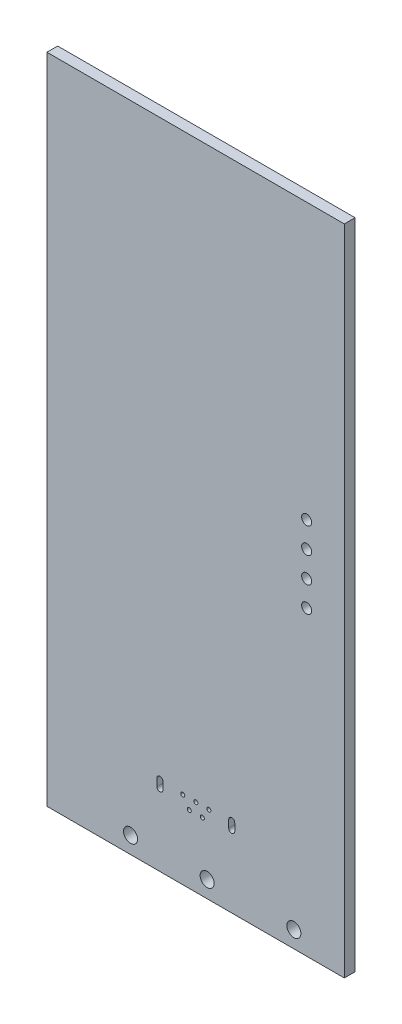
from build123d import *

# Parameters (mm, degrees)
SKETCH_1_W         = 29.6
SKETCH_1_H         = 65
BOARD_DEPTH        = 1.07112
SKETCH_13_R        = 0.5
HOLE_OLED1_4_DEPTH = 1.07112
SKETCH_14_R        = 0.5
HOLE_OLED1_3_DEPTH = 148.296881579
SKETCH_15_R        = 0.5
HOLE_OLED1_2_DEPTH = 148.296881579
SKETCH_16_R        = 0.5
HOLE_OLED1_1_DEPTH = 148.296881579
SKETCH_17_R        = 0.7
HOLE_FREE_4_DEPTH  = 148.296881579
SKETCH_18_R        = 0.7
HOLE_FREE_3_DEPTH  = 148.296881579
SKETCH_19_R        = 0.7
HOLE_FREE_2_DEPTH  = 148.296881579
HOLE_J1_6_DEPTH    = 148.296881579
HOLE_J1_7_DEPTH    = 148.296881579
SKETCH_24_R        = 0.2
HOLE_J1_1_DEPTH    = 148.296881579
SKETCH_25_R        = 0.2
HOLE_J1_2_DEPTH    = 148.296881579
SKETCH_26_R        = 0.2
HOLE_J1_3_DEPTH    = 148.296881579
SKETCH_27_R        = 0.2
HOLE_J1_4_DEPTH    = 148.296881579
SKETCH_28_R        = 0.2
HOLE_J1_5_DEPTH    = 148.296881579


with BuildPart() as part:
    # Эскиз1 → Board (new body)
    with BuildSketch(Plane.XY):
        with Locations((71.88103, 86.58662)):
            Rectangle(SKETCH_1_W, SKETCH_1_H)
    extrude(amount=BOARD_DEPTH)

    # Эскиз13 → Hole - OLED1-4 (cut)
    with BuildSketch(Plane.XY.offset(1.07112)):
        with Locations((82.93099, 84.09263)):
            Circle(SKETCH_13_R)
    extrude(amount=-HOLE_OLED1_4_DEPTH, mode=Mode.SUBTRACT)

    # Эскиз14 → Hole - OLED1-3 (cut, through all)
    with BuildSketch(Plane.XY.offset(1.07112)):
        with Locations((82.931, 86.63263)):
            Circle(SKETCH_14_R)
    extrude(amount=-HOLE_OLED1_3_DEPTH, mode=Mode.SUBTRACT)

    # Эскиз15 → Hole - OLED1-2 (cut, through all)
    with BuildSketch(Plane.XY.offset(1.07112)):
        with Locations((82.931, 89.17263)):
            Circle(SKETCH_15_R)
    extrude(amount=-HOLE_OLED1_2_DEPTH, mode=Mode.SUBTRACT)

    # Эскиз16 → Hole - OLED1-1 (cut, through all)
    with BuildSketch(Plane.XY.offset(1.07112)):
        with Locations((82.931, 91.71263)):
            Circle(SKETCH_16_R)
    extrude(amount=-HOLE_OLED1_1_DEPTH, mode=Mode.SUBTRACT)

    # Эскиз17 → Hole - Free-4 (cut, through all)
    with BuildSketch(Plane.XY.offset(1.07112)):
        with Locations((73.025, 55.753)):
            Circle(SKETCH_17_R)
    extrude(amount=-HOLE_FREE_4_DEPTH, mode=Mode.SUBTRACT)

    # Эскиз18 → Hole - Free-3 (cut, through all)
    with BuildSketch(Plane.XY.offset(1.07112)):
        with Locations((81.661, 55.753)):
            Circle(SKETCH_18_R)
    extrude(amount=-HOLE_FREE_3_DEPTH, mode=Mode.SUBTRACT)

    # Эскиз19 → Hole - Free-2 (cut, through all)
    with BuildSketch(Plane.XY.offset(1.07112)):
        with Locations((65.405, 55.753)):
            Circle(SKETCH_19_R)
    extrude(amount=-HOLE_FREE_2_DEPTH, mode=Mode.SUBTRACT)

    # Эскиз21 → Hole - J1-6 (cut, through all)
    with BuildSketch(Plane.XY.offset(1.07112)):
        with BuildLine():
            Line((68.0259, 61.25658), (68.0259, 62.00658))
            ThreePointArc((68.0259, 62.00658), (68.3259, 62.30658), (68.6259, 62.00658))
            Line((68.6259, 62.00658), (68.6259, 61.25658))
            ThreePointArc((68.6259, 61.25658), (68.3259, 60.95658), (68.0259, 61.25658))
        make_face()
    extrude(amount=-HOLE_J1_6_DEPTH, mode=Mode.SUBTRACT)

    # Эскиз23 → Hole - J1-7 (cut, through all)
    with BuildSketch(Plane.XY.offset(1.07112)):
        with BuildLine():
            Line((75.17589, 61.25658), (75.17589, 62.00658))
            ThreePointArc((75.17589, 62.00658), (75.47589, 62.30658), (75.77589, 62.00658))
            Line((75.77589, 62.00658), (75.77589, 61.25658))
            ThreePointArc((75.77589, 61.25658), (75.47589, 60.95658), (75.17589, 61.25658))
        make_face()
    extrude(amount=-HOLE_J1_7_DEPTH, mode=Mode.SUBTRACT)

    # Эскиз24 → Hole - J1-1 (cut, through all)
    with BuildSketch(Plane.XY.offset(1.07112)):
        with Locations((70.6009, 61.85156)):
            Circle(SKETCH_24_R)
    extrude(amount=-HOLE_J1_1_DEPTH, mode=Mode.SUBTRACT)

    # Эскиз25 → Hole - J1-2 (cut, through all)
    with BuildSketch(Plane.XY.offset(1.07112)):
        with Locations((71.25089, 60.85157)):
            Circle(SKETCH_25_R)
    extrude(amount=-HOLE_J1_2_DEPTH, mode=Mode.SUBTRACT)

    # Эскиз26 → Hole - J1-3 (cut, through all)
    with BuildSketch(Plane.XY.offset(1.07112)):
        with Locations((71.90091, 61.85157)):
            Circle(SKETCH_26_R)
    extrude(amount=-HOLE_J1_3_DEPTH, mode=Mode.SUBTRACT)

    # Эскиз27 → Hole - J1-4 (cut, through all)
    with BuildSketch(Plane.XY.offset(1.07112)):
        with Locations((72.55091, 60.85157)):
            Circle(SKETCH_27_R)
    extrude(amount=-HOLE_J1_4_DEPTH, mode=Mode.SUBTRACT)

    # Эскиз28 → Hole - J1-5 (cut, through all)
    with BuildSketch(Plane.XY.offset(1.07112)):
        with Locations((73.20089, 61.85158)):
            Circle(SKETCH_28_R)
    extrude(amount=-HOLE_J1_5_DEPTH, mode=Mode.SUBTRACT)


solid = part.part
